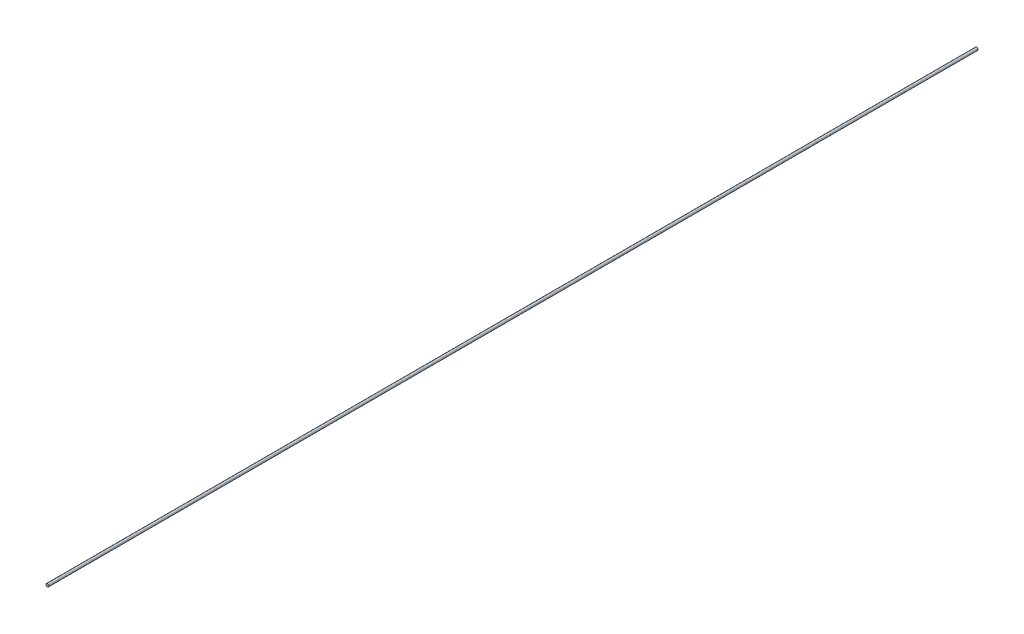
from build123d import *

# Parameters (mm, degrees)
SKETCH1_R           = 25.4
BOSS_EXTRUDE1_DEPTH = 16757.255214248


with BuildPart() as part:
    # Sketch1 → Boss-Extrude1 (new body)
    with BuildSketch(Plane.XY):
        Circle(SKETCH1_R)
    extrude(amount=BOSS_EXTRUDE1_DEPTH)


solid = part.part
